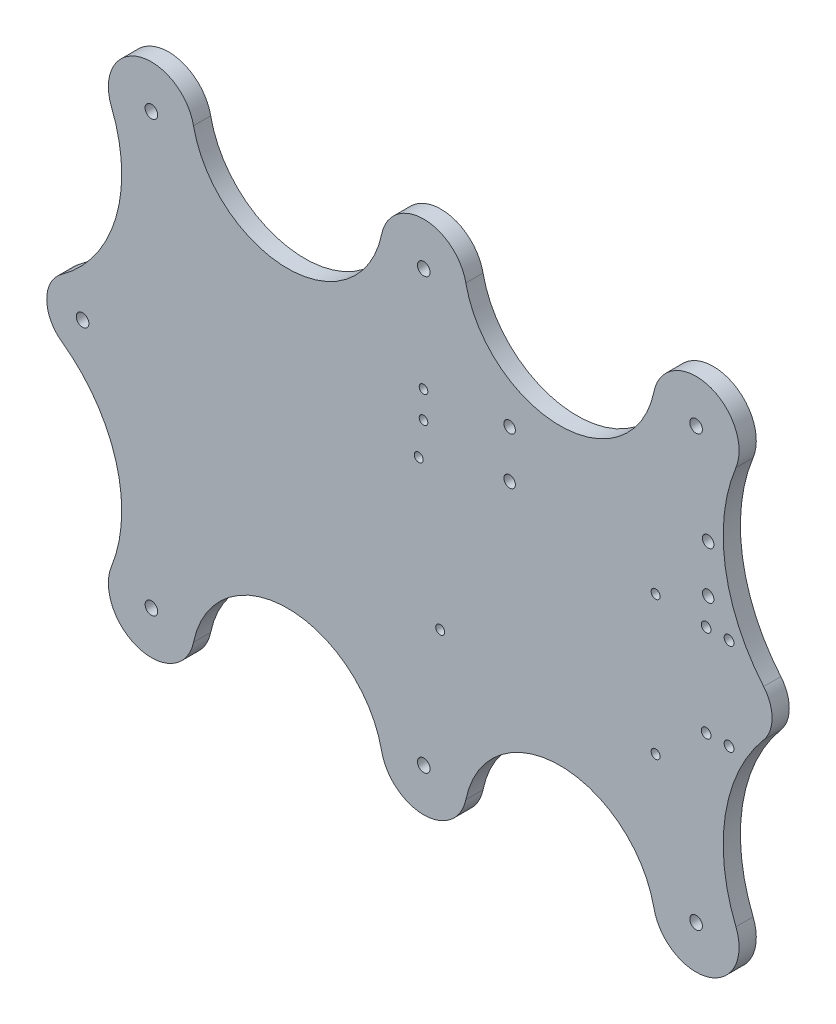
from build123d import *

# Parameters (mm, degrees)
BOSS_EXTRUDE1_DEPTH = 6
SKETCH3_R           = 2.2
SKETCH3_R_2         = 1.7
CUT_EXTRUDE1_DEPTH  = 263.645900158
SKETCH9_R           = 1.5
CUT_EXTRUDE7_DEPTH  = 263.645900158
SKETCH10_R          = 2
CUT_EXTRUDE8_DEPTH  = 263.645900158
SKETCH11_R          = 1.5621
CUT_EXTRUDE9_DEPTH  = 263.645900158


with BuildPart() as part:
    # Sketch2 → Boss-Extrude1 (new body)
    with BuildSketch(Plane.XY):
        with BuildLine():
            ThreePointArc((14.643567385, -34.35021296), (17.582213792, -26.298472933), (14.643567385, -18.246732906))
            ThreePointArc((14.643567385, -18.246732906), (1.271257198, 11.050387409), (4.97338396, 43.041545498))
            ThreePointArc((4.97338396, 43.041545498), (-4.554295145, 63.052831737), (-23.608507858, 51.731823656))
            ThreePointArc((-23.608507858, 51.731823656), (-56.417786208, 24.999486038), (-89.227064559, 51.731823656))
            ThreePointArc((-89.227064559, 51.731823656), (-103.917786208, 63.701527067), (-118.608507858, 51.731823656))
            ThreePointArc((-118.608507858, 51.731823656), (-151.417786208, 24.999486038), (-184.227064559, 51.731823656))
            ThreePointArc((-184.227064559, 51.731823656), (-203.236955544, 63.06623299), (-212.843634986, 43.127414061))
            ThreePointArc((-212.843634986, 43.127414061), (-211.27621055, 10.502270588), (-230.186855149, -16.129370872))
            ThreePointArc((-230.186855149, -16.129370872), (-235.417786208, -26.298472933), (-230.186855149, -36.467574994))
            ThreePointArc((-230.186855149, -36.467574994), (-211.27621055, -63.099216454), (-212.843634986, -95.724359927))
            ThreePointArc((-212.843634986, -95.724359927), (-203.236955544, -115.663178856), (-184.227064559, -104.328769522))
            ThreePointArc((-184.227064559, -104.328769522), (-151.417786208, -77.596431904), (-118.608507858, -104.328769522))
            ThreePointArc((-118.608507858, -104.328769522), (-103.917786208, -116.298472933), (-89.227064559, -104.328769522))
            ThreePointArc((-89.227064559, -104.328769522), (-56.417786208, -77.596431904), (-23.608507858, -104.328769522))
            ThreePointArc((-23.608507858, -104.328769522), (-4.554295145, -115.649777603), (4.97338396, -95.638491364))
            ThreePointArc((4.97338396, -95.638491364), (1.271257198, -63.647333275), (14.643567385, -34.35021296))
        make_face()
    extrude(amount=BOSS_EXTRUDE1_DEPTH)

    # Sketch3 → Cut-Extrude1 (cut, through all)
    with BuildSketch(Plane.XY.offset(6)):
        with Locations((-222.917786208, -26.298472933)):
            Circle(SKETCH3_R)
        with Locations((-198.917786208, -101.298472933)):
            Circle(SKETCH3_R)
        with Locations((-103.917786208, -101.298472933)):
            Circle(SKETCH3_R)
        with Locations((-8.917786208, -101.298472933)):
            Circle(SKETCH3_R)
        with Locations((-5.417786208, -10.298472933)):
            Circle(SKETCH3_R_2)
        with Locations((-5.417786208, -42.298472933)):
            Circle(SKETCH3_R_2)
        with Locations((2.582213792, -42.298472933)):
            Circle(SKETCH3_R_2)
        with Locations((2.582213792, -10.298472933)):
            Circle(SKETCH3_R_2)
        with Locations((-8.917786208, 48.701527067)):
            Circle(SKETCH3_R)
        with Locations((-103.917786208, 48.701527067)):
            Circle(SKETCH3_R)
        with Locations((-198.917786208, 48.701527067)):
            Circle(SKETCH3_R)
    extrude(amount=-CUT_EXTRUDE1_DEPTH, mode=Mode.SUBTRACT)

    # Sketch9 → Cut-Extrude7 (cut, through all)
    with BuildSketch(Plane.XY.offset(6)):
        with Locations((-103.99500987, 12.281928067)):
            Circle(SKETCH9_R)
        with Locations((-103.99500987, 2.917326067)):
            Circle(SKETCH9_R)
    extrude(amount=-CUT_EXTRUDE7_DEPTH, mode=Mode.SUBTRACT)

    # Sketch10 → Cut-Extrude8 (cut, through all)
    with BuildSketch(Plane.XY.offset(6)):
        with Locations((-4.70262179, 15.909627067)):
            Circle(SKETCH10_R)
        with Locations((-4.70262179, -0.590372933)):
            Circle(SKETCH10_R)
        with Locations((-73.95262179, 15.909627067)):
            Circle(SKETCH10_R)
        with Locations((-73.95262179, -0.590372933)):
            Circle(SKETCH10_R)
    extrude(amount=-CUT_EXTRUDE8_DEPTH, mode=Mode.SUBTRACT)

    # Sketch11 → Cut-Extrude9 (cut, through all)
    with BuildSketch(Plane.XY.offset(6)):
        with Locations((-23.040186208, -9.130372933)):
            Circle(SKETCH11_R)
        with Locations((-23.040186208, -57.466572933)):
            Circle(SKETCH11_R)
        with Locations((-105.666386208, -9.130372933)):
            Circle(SKETCH11_R)
        with Locations((-98.173386208, -57.466572933)):
            Circle(SKETCH11_R)
    extrude(amount=-CUT_EXTRUDE9_DEPTH, mode=Mode.SUBTRACT)


solid = part.part
